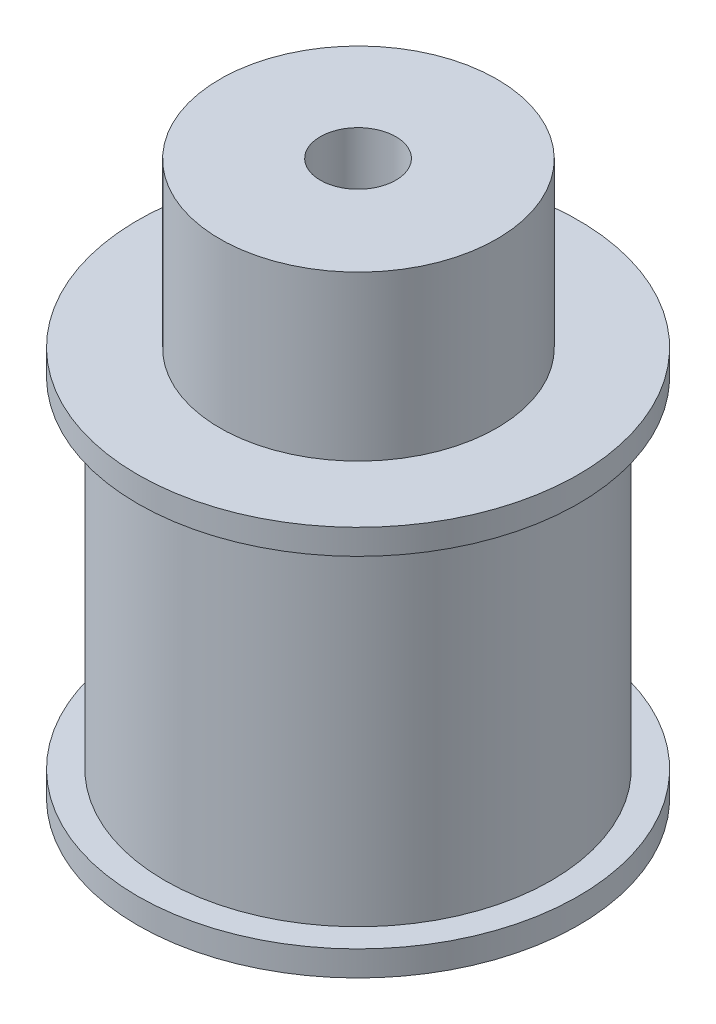
from build123d import *

# Parameters (mm, degrees)
SKETCH_1_R          = 15.345
EXTRUDE_1_DEPTH     = 13.5
SKETCH_2_R          = 17.5
EXTRUDE_2_DEPTH     = 2
SKETCH_4_R          = 11
EXTRUDE_3_DEPTH     = 13
SKETCH_3_R          = 3
CUT_EXTRUDE_1_DEPTH = 51.482670294


with BuildPart() as part:
    # 草图1 → 凸台-拉伸1 (new, symmetric)
    with BuildSketch(Plane(origin=(0, 0, 0), x_dir=(1, 0, 0), z_dir=(0, 1, 0))):
        with Locations(Location((0, 0, 0), (0, 0, 270))):
            Circle(SKETCH_1_R)
    extrude(amount=EXTRUDE_1_DEPTH, both=True)

    # 草图2 → 凸台-拉伸2 (add)
    with BuildSketch(Plane(origin=(0, 13.5, 0), x_dir=(1, 0, 0), z_dir=(0, 1, 0))):
        with Locations(Location((0, 0, 0), (0, 0, 270))):
            Circle(SKETCH_2_R)
    extrude_2 = extrude(amount=EXTRUDE_2_DEPTH)

    # 镜向1: 凸台-拉伸2 across plane
    add(extrude_2.mirror(Plane.ZX))

    # 草图4 → 凸台-拉伸3 (add)
    with BuildSketch(Plane(origin=(0, 15.5, 0), x_dir=(1, 0, 0), z_dir=(0, 1, 0))):
        with Locations(Location((0.058014503, -0.029170846, 0), (0, 0, 90))):
            Circle(SKETCH_4_R)
    extrude(amount=EXTRUDE_3_DEPTH)

    # 草图3 → 切除-拉伸1 (cut, through all)
    with BuildSketch(Plane(origin=(0, -15.5, 0), x_dir=(1, 0, 0), z_dir=(0, 1, 0))):
        with Locations(Location((0, 0, 0), (0, 0, 270))):
            Circle(SKETCH_3_R)
    extrude(amount=CUT_EXTRUDE_1_DEPTH, mode=Mode.SUBTRACT)


solid = part.part
